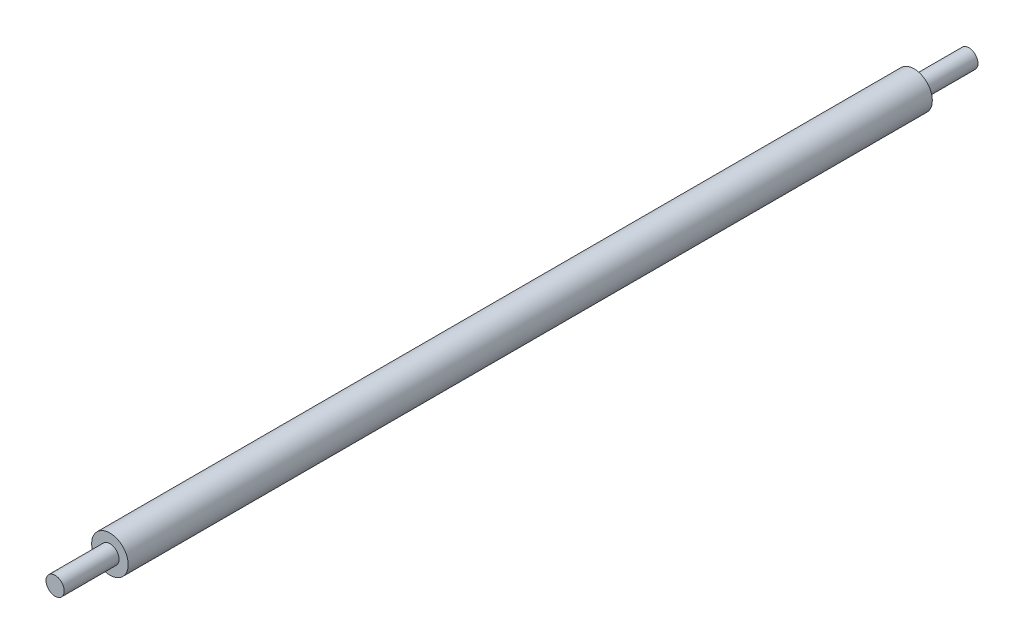
from build123d import *

# Parameters (mm, degrees)
CROQUIS1_R              = 0.05
SALIENTE_EXTRUIR1_DEPTH = 2.5
CROQUIS3_R              = 0.05
CORTAR_EXTRUIR1_DEPTH   = 3.351063589
CROQUIS4_R              = 0.025
SALIENTE_EXTRUIR2_DEPTH = 0.15
CROQUIS5_R              = 0.05
CORTAR_EXTRUIR2_DEPTH   = 0.15
CROQUIS6_R              = 0.024951655
SALIENTE_EXTRUIR3_DEPTH = 0.15


with BuildPart() as part:
    # Croquis1 → Saliente-Extruir1 (new body)
    with BuildSketch(Plane.XY):
        Circle(CROQUIS1_R)
    extrude(amount=SALIENTE_EXTRUIR1_DEPTH)

    # Croquis3 → Cortar-Extruir1 (cut, through all)
    with BuildSketch(Plane.XY.offset(0.15)):
        Circle(CROQUIS3_R)
    extrude(amount=-CORTAR_EXTRUIR1_DEPTH, mode=Mode.SUBTRACT)

    # Croquis4 → Saliente-Extruir2 (add)
    with BuildSketch(Plane.XY.offset(0.15)):
        Circle(CROQUIS4_R)
    extrude(amount=-SALIENTE_EXTRUIR2_DEPTH)

    # Croquis5 → Cortar-Extruir2 (cut)
    with BuildSketch(Plane.XY.offset(2.35)):
        Circle(CROQUIS5_R)
    extrude(amount=CORTAR_EXTRUIR2_DEPTH, mode=Mode.SUBTRACT)

    # Croquis6 → Saliente-Extruir3 (add)
    with BuildSketch(Plane.XY.offset(2.35)):
        Circle(CROQUIS6_R)
    extrude(amount=SALIENTE_EXTRUIR3_DEPTH)


solid = part.part
